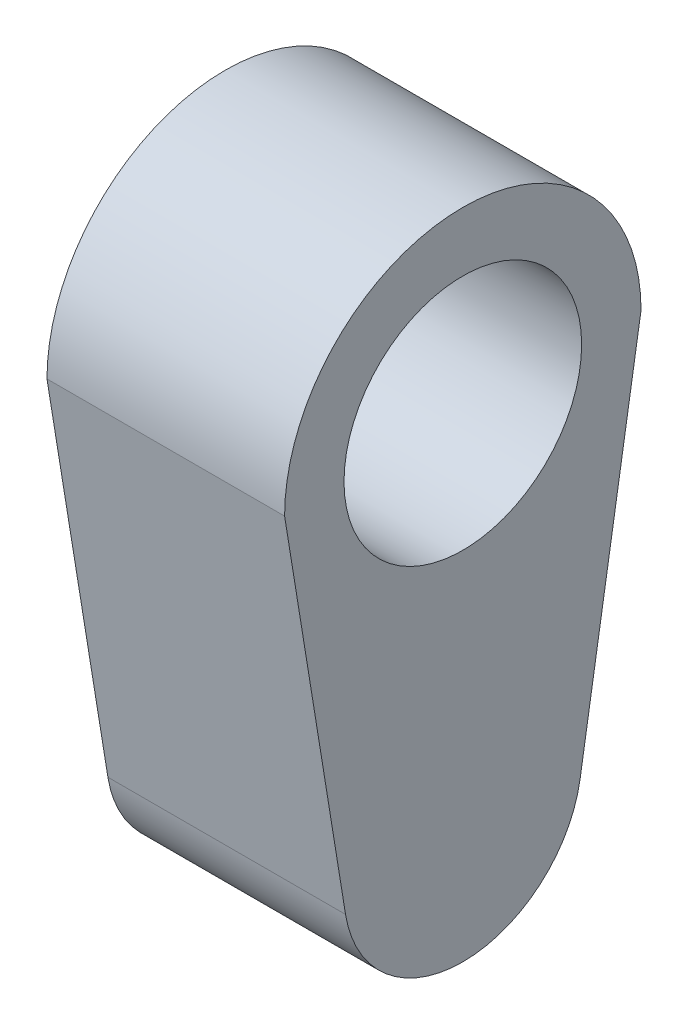
from build123d import *

# Parameters (mm, degrees)
SKETCH1_R           = 2.54
BOSS_EXTRUDE1_DEPTH = 5.08
SKETCH1_2_R         = 2.54
BOSS_EXTRUDE2_DEPTH = 1.016


with BuildPart() as part:
    # Sketch1 → Boss-Extrude1 (new body)
    with BuildSketch(Plane(origin=(0, 0, 0), x_dir=(0, 0, -1), z_dir=(1, 0, 0))):
        with BuildLine():
            Line((-3.81, 0), (-2.507191408, -8.026929038))
            ThreePointArc((-2.507191408, -8.026929038), (0, -10.16), (2.507191408, -8.026929038))
            Line((2.507191408, -8.026929038), (3.81, 0))
            ThreePointArc((3.81, 0), (0, 3.81), (-3.81, 0))
        make_face()
        Circle(SKETCH1_R, mode=Mode.SUBTRACT)
    extrude(amount=BOSS_EXTRUDE1_DEPTH)

    # Sketch1<2> → Boss-Extrude2 (add)
    with BuildSketch(Plane(origin=(0, 0, 0), x_dir=(0, 0, -1), z_dir=(1, 0, 0))):
        Circle(SKETCH1_2_R)
    extrude(amount=BOSS_EXTRUDE2_DEPTH)


solid = part.part
